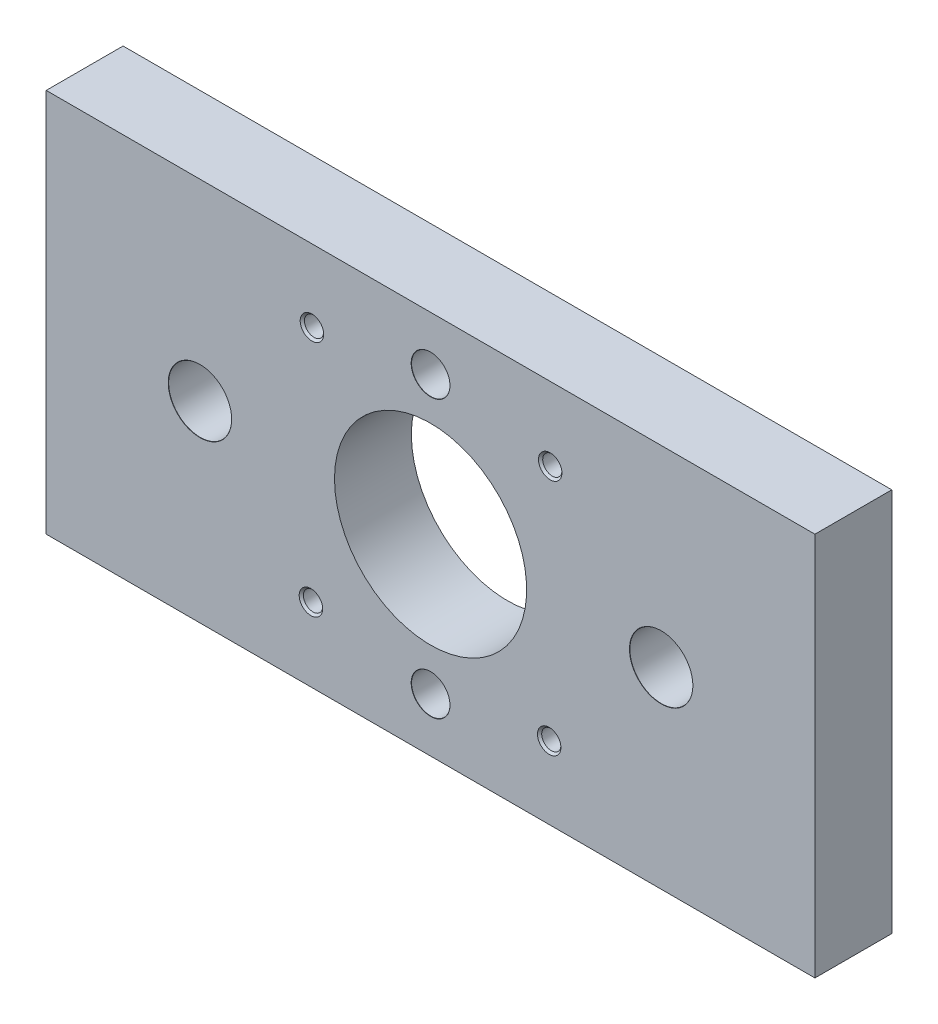
from build123d import *

# Parameters (mm, degrees)
SKETCH_1_W                      = 100
SKETCH_1_H                      = 50
EXTRUDE_1_DEPTH                 = 10
HOLE_WIZARD_5_0_5_1_D           = 5
HOLE_WIZARD_5_0_5_1_CSINK_D     = 5.05
HOLE_WIZARD_5_0_5_1_CSINK_ANGLE = 90
SKETCH_20_R                     = 5
CUT_EXTRUDE_1_DEPTH             = 57.789083458
SKETCH_26_R                     = 12.5
CUT_EXTRUDE_2_DEPTH             = 2.5
HOLE_WIZARD_M3_1_D              = 2.5
HOLE_WIZARD_M3_1_CSINK_D        = 3.05
HOLE_WIZARD_M3_1_CSINK_ANGLE    = 90
SKETCH_35_R                     = 12.5
CUT_EXTRUDE_3_DEPTH             = 57.402570863


with BuildPart() as part:
    # 草图1 → 凸台-拉伸1 (new body)
    with BuildSketch(Plane.XY):
        Rectangle(SKETCH_1_W, SKETCH_1_H)
    extrude(amount=EXTRUDE_1_DEPTH)

    # Ø5.0 (5) 直径孔1 (through all)
    with Locations(Plane.XY.offset(10)):
        with Locations((0, 18), (0, -18)):
            CounterSinkHole(HOLE_WIZARD_5_0_5_1_D / 2, HOLE_WIZARD_5_0_5_1_CSINK_D / 2, counter_sink_angle=HOLE_WIZARD_5_0_5_1_CSINK_ANGLE)

    # 草图20 → 切除-拉伸1 (cut, through all)
    with BuildSketch(Plane.XY.offset(10)):
        Circle(SKETCH_20_R)
    extrude(amount=-CUT_EXTRUDE_1_DEPTH, mode=Mode.SUBTRACT)

    # 草图25 → Ø8.2 (8.2) 直径孔1 (revolve, cut)
    with BuildSketch(Plane(origin=(30, 0, 10), x_dir=(0, -1, 0), z_dir=(1, 0, 0))):
        Polygon((0, 0), (0, 10), (4.125, 10), (4.1, 9.975), (4.1, 0.025), (4.125, 0), align=None)
    hole_wizard_8_2_8_2_1 = revolve(axis=Axis((30, 0, 16.35), (0, 0, -1)), mode=Mode.SUBTRACT)

    # 镜向1: Ø8.2 (8.2) 直径孔1 across plane
    add(hole_wizard_8_2_8_2_1.mirror(Plane(origin=(0, 0, 0), x_dir=(0, 0, 1), z_dir=(1, 0, 0))), mode=Mode.SUBTRACT)

    # 草图26 → 切除-拉伸2 (cut)
    with BuildSketch(Plane(origin=(0, 0, 0), x_dir=(-1, 0, 0), z_dir=(0, 0, -1))):
        Circle(SKETCH_26_R)
    extrude(amount=-CUT_EXTRUDE_2_DEPTH, mode=Mode.SUBTRACT)

    # M3 螺纹孔1 (through all)
    with Locations(Plane.XY.offset(10)):
        with Locations((15.565692097, 15.434028299), (15.434028299, -15.565692097), (-15.565692097, -15.434028299), (-15.434028299, 15.565692097)):
            CounterSinkHole(HOLE_WIZARD_M3_1_D / 2, HOLE_WIZARD_M3_1_CSINK_D / 2, counter_sink_angle=HOLE_WIZARD_M3_1_CSINK_ANGLE)

    # 草图35 → 切除-拉伸3 (cut, through all)
    with BuildSketch(Plane(origin=(0, 0, 2.5), x_dir=(-1, 0, 0), z_dir=(0, 0, -1))):
        Circle(SKETCH_35_R)
    extrude(amount=-CUT_EXTRUDE_3_DEPTH, mode=Mode.SUBTRACT)


solid = part.part
